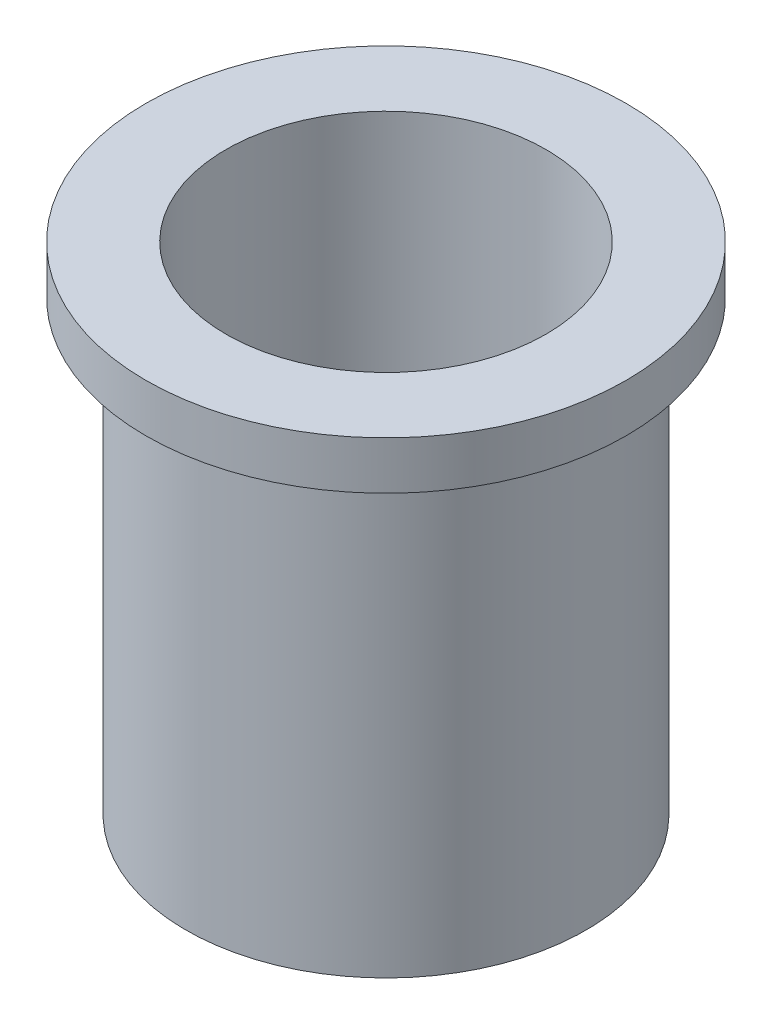
from build123d import *

# Parameters (mm, degrees)
SKETCH2_R          = 10
CUT_EXTRUDE1_DEPTH = 38.563279942


with BuildPart() as part:
    # Sketch1 → Revolve1 (revolve)
    with BuildSketch(Plane.XY, mode=Mode.PRIVATE) as revolve1_sk:
        Polygon((12.5, 6.108108108), (15, 6.108108108), (15, 9.108108108), (0, 9.108108108), (0, -21.891891892), (12.5, -21.891891892), align=None)
    revolve(revolve1_sk.sketch.rotate(Axis((0, 40.346949903, 0), (0, -1, 0)), 180), axis=Axis((0, 40.346949903, 0), (0, -1, 0)))

    # Sketch2 → Cut-Extrude1 (cut, through all)
    with BuildSketch(Plane.XZ.offset(21.891891892)):
        Circle(SKETCH2_R)
    extrude(amount=-CUT_EXTRUDE1_DEPTH, mode=Mode.SUBTRACT)


solid = part.part
